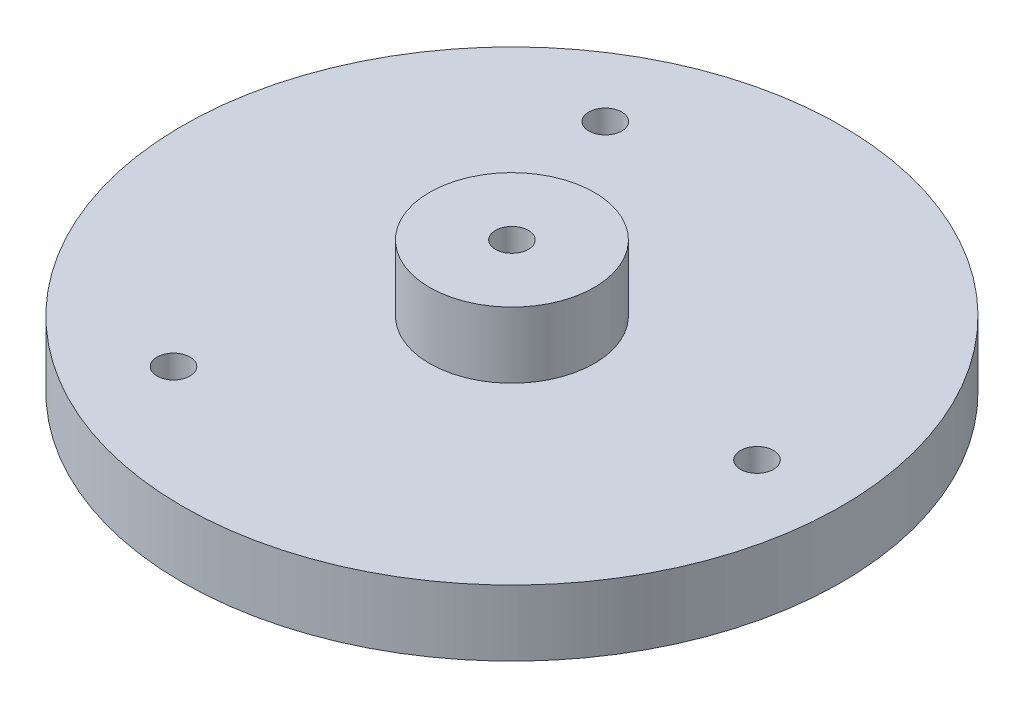
from build123d import *

# Parameters (mm, degrees)
SKETCH1_R           = 100
SKETCH1_R_2         = 5
SKETCH1_R_3         = 25
BOSS_EXTRUDE1_DEPTH = 20
SKETCH1_3_R         = 25
SKETCH1_3_R_2       = 5
BOSS_EXTRUDE2_DEPTH = 40


with BuildPart() as part:
    # Sketch1 → Boss-Extrude1 (new body)
    with BuildSketch(Plane(origin=(0, 0, 0), x_dir=(1, 0, 0), z_dir=(0, 1, 0))):
        Circle(SKETCH1_R)
        with Locations((-36.941689274, 65.271062452)):
            Circle(SKETCH1_R_2, mode=Mode.SUBTRACT)
        with Locations((-38.055553578, -64.627972596)):
            Circle(SKETCH1_R_2, mode=Mode.SUBTRACT)
        with Locations((74.997242852, -0.643089856)):
            Circle(SKETCH1_R_2, mode=Mode.SUBTRACT)
        Circle(SKETCH1_R_3, mode=Mode.SUBTRACT)
    extrude(amount=BOSS_EXTRUDE1_DEPTH)

    # Sketch1<3> → Boss-Extrude2 (add)
    with BuildSketch(Plane(origin=(0, 0, 0), x_dir=(1, 0, 0), z_dir=(0, 1, 0))):
        Circle(SKETCH1_3_R)
        Circle(SKETCH1_3_R_2, mode=Mode.SUBTRACT)
    extrude(amount=BOSS_EXTRUDE2_DEPTH)


solid = part.part
